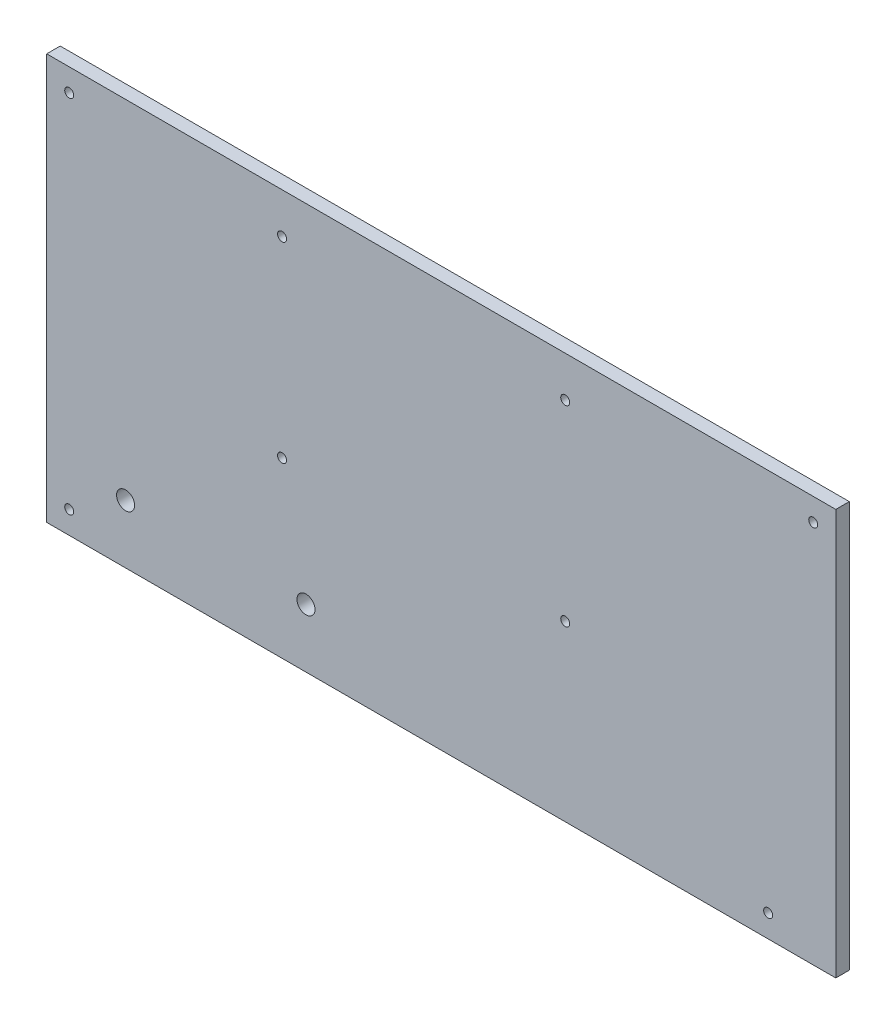
from build123d import *

# Parameters (mm, degrees)
ESBO_O1_W                = 350
ESBO_O1_H                = 180
ESBO_O1_R                = 2
ESBO_O1_R_2              = 4
RESSALTO_EXTRUS_O1_DEPTH = 6
ESBO_O2_R                = 2
CORTE_EXTRUS_O1_DEPTH    = 10


with BuildPart() as part:
    # Esboço1 → Ressalto-extrusão1 (new body)
    with BuildSketch(Plane.XY):
        Rectangle(ESBO_O1_W, ESBO_O1_H)
        with Locations((145, -80)):
            Circle(ESBO_O1_R, mode=Mode.SUBTRACT)
        with Locations((165, 80)):
            Circle(ESBO_O1_R, mode=Mode.SUBTRACT)
        with Locations((-165, 80)):
            Circle(ESBO_O1_R, mode=Mode.SUBTRACT)
        with Locations((-165, -80)):
            Circle(ESBO_O1_R, mode=Mode.SUBTRACT)
        with Locations((-140, -64)):
            Circle(ESBO_O1_R_2, mode=Mode.SUBTRACT)
        with Locations((-60, -64)):
            Circle(ESBO_O1_R_2, mode=Mode.SUBTRACT)
    extrude(amount=RESSALTO_EXTRUS_O1_DEPTH)

    # Esboço2 → Corte-extrusão1 (cut)
    with BuildSketch(Plane.XY.offset(6)):
        with Locations((55, 72)):
            Circle(ESBO_O2_R)
        with Locations((-70.6, 72)):
            Circle(ESBO_O2_R)
        with Locations((-70.6, -13)):
            Circle(ESBO_O2_R)
        with Locations((55, -13)):
            Circle(ESBO_O2_R)
    extrude(amount=-CORTE_EXTRUS_O1_DEPTH, mode=Mode.SUBTRACT)


solid = part.part
